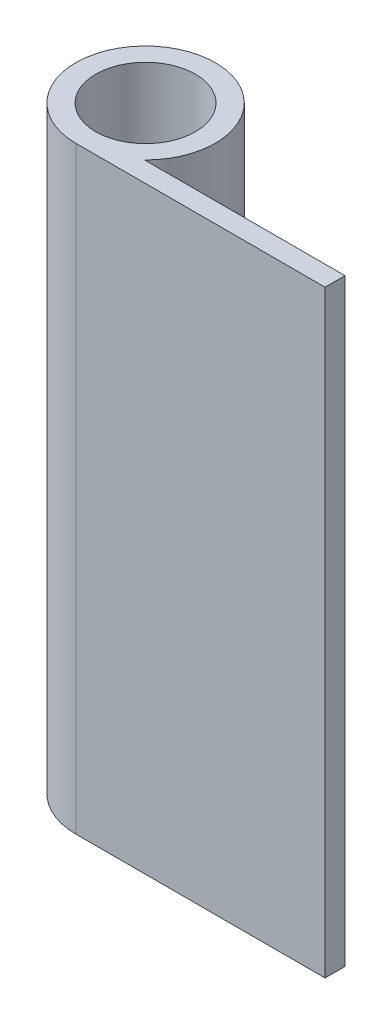
from build123d import *

# Parameters (mm, degrees)
SKETCH1_R           = 5
BOSS_EXTRUDE1_DEPTH = 30


with BuildPart() as part:
    # Sketch1 → Boss-Extrude1 (new, symmetric)
    with BuildSketch(Plane(origin=(0, 0, 0), x_dir=(1, 0, 0), z_dir=(0, 1, 0))):
        with BuildLine():
            Line((0, -7), (25, -7))
            Line((25, -7), (25, -5))
            Line((25, -5), (4.898979486, -5))
            ThreePointArc((4.898979486, -5), (-2.645751311, 6.480740698), (0, -7))
        make_face()
        with Locations(Location((0, 0, 0), (0, 0, 270))):
            Circle(SKETCH1_R, mode=Mode.SUBTRACT)
    extrude(amount=BOSS_EXTRUDE1_DEPTH, both=True)


solid = part.part
